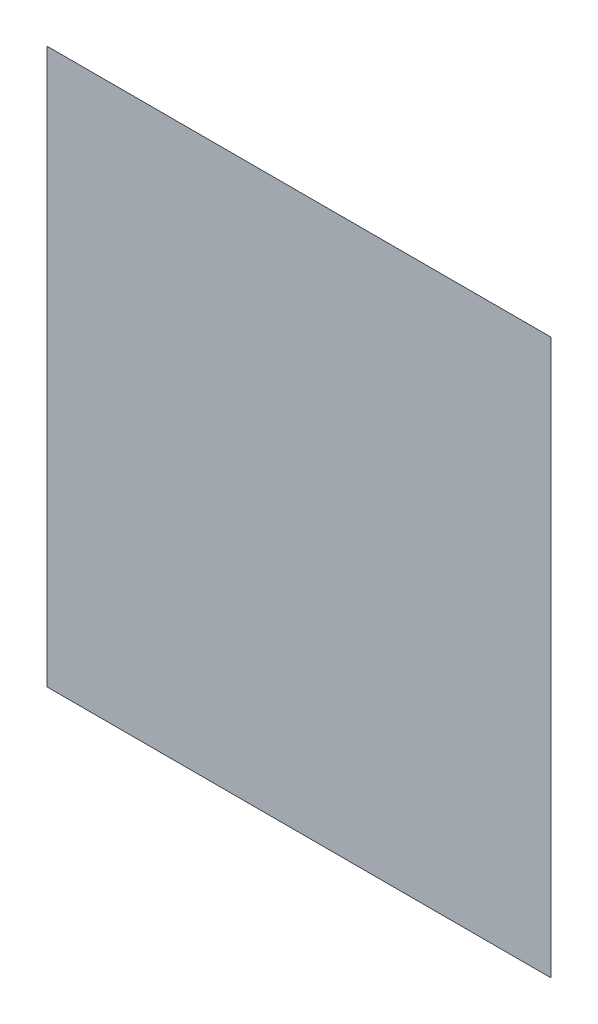
from build123d import *

# Parameters (mm, degrees)
SKETCH1_W           = 20
SKETCH1_H           = 22
BOSS_EXTRUDE1_DEPTH = 0.0001


with BuildPart() as part:
    # Sketch1 → Boss-Extrude1 (new body)
    with BuildSketch(Plane.XY):
        Rectangle(SKETCH1_W, SKETCH1_H)
    extrude(amount=BOSS_EXTRUDE1_DEPTH)


solid = part.part
